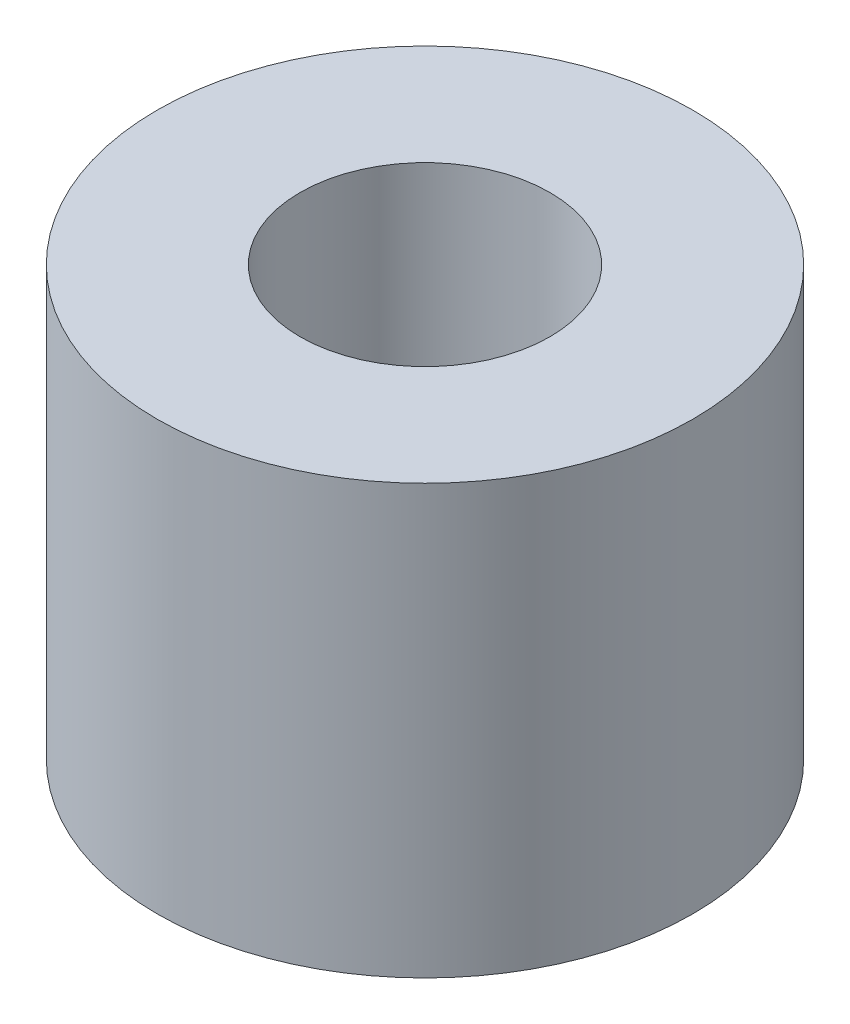
from build123d import *

# Parameters (mm, degrees)
SKETCH1_R           = 23.8125
SKETCH1_R_2         = 11.1125
BOSS_EXTRUDE1_DEPTH = 38.1


with BuildPart() as part:
    # Sketch1 → Boss-Extrude1 (new body)
    with BuildSketch(Plane(origin=(0, 0, 0), x_dir=(1, 0, 0), z_dir=(0, 1, 0))):
        with Locations(Location((0, 0, 0), (0, 0, 90))):
            Circle(SKETCH1_R)
        with Locations(Location((0, 0, 0), (0, 0, 90))):
            Circle(SKETCH1_R_2, mode=Mode.SUBTRACT)
    extrude(amount=BOSS_EXTRUDE1_DEPTH)


solid = part.part
